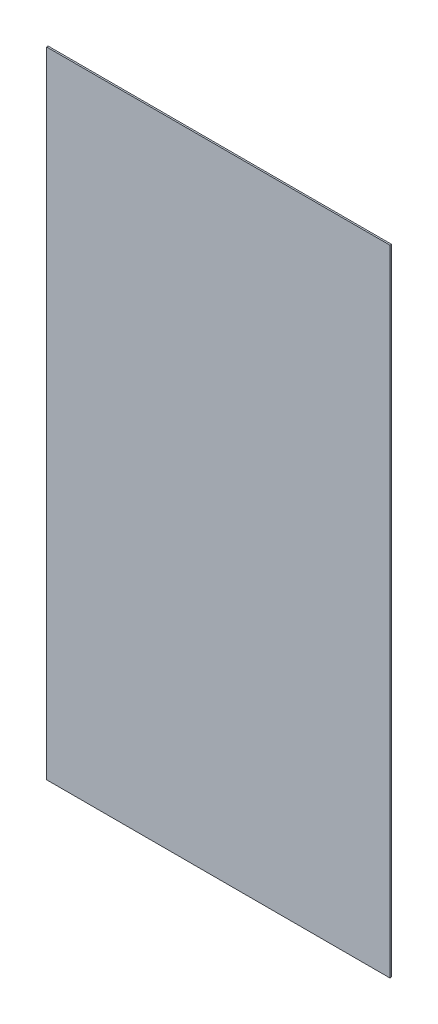
from build123d import *

# Parameters (mm, degrees)
PRESS_PANEL_UST_SAG_1_START = 38.5
SKETCH1_W                   = 330
SKETCH1_H                   = 610
PRESS_PANEL_UST_SAG_1_DEPTH = 1.5


with BuildPart() as part:
    # Sketch1 → PRESS_panel_ust_sag_1 (new body)
    with BuildSketch(Plane.XY.offset(PRESS_PANEL_UST_SAG_1_START)):
        with Locations((505, 1645)):
            Rectangle(SKETCH1_W, SKETCH1_H)
    extrude(amount=PRESS_PANEL_UST_SAG_1_DEPTH)


solid = part.part
